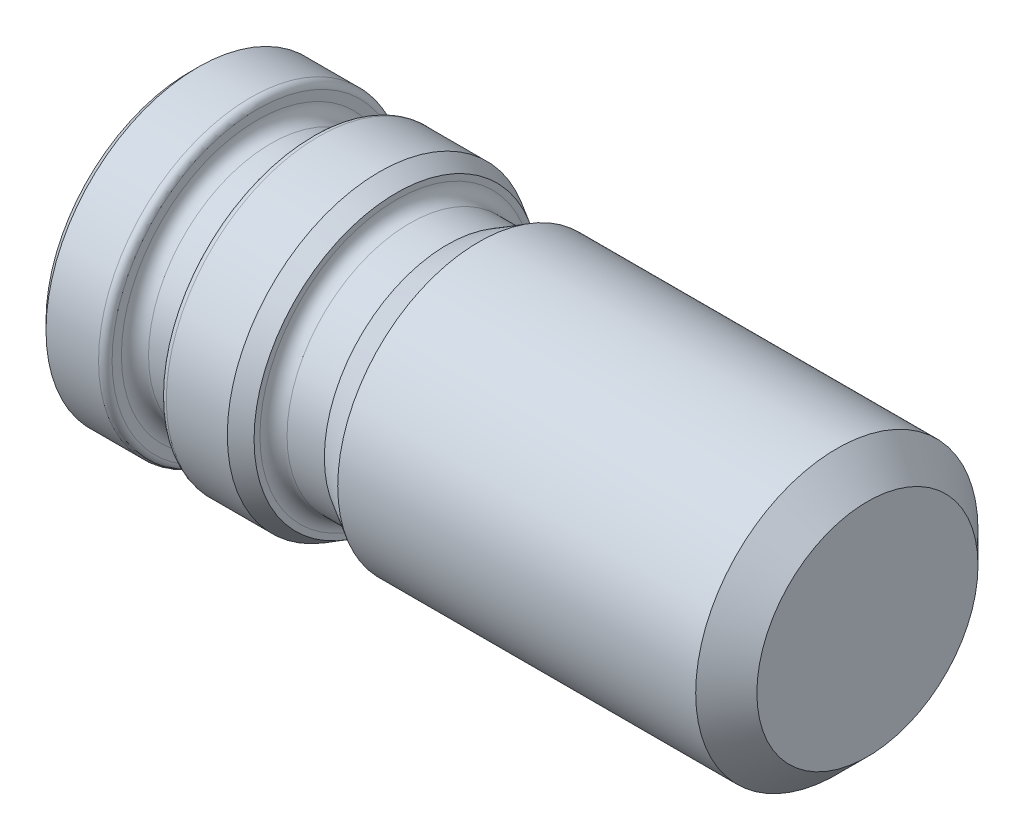
from build123d import *

# Parameters (mm, degrees)
CUT_EXTRUDE1_DEPTH = 8
CHAMFER1_SIZE      = 0.5
CHAMFER2_SIZE      = 0.5
CHAMFER3_SIZE      = 1
CHAMFER3_SIZE2     = 0.577350269


with BuildPart() as part:
    # Sketch1 → Revolve1 (revolve)
    with BuildSketch(Plane.XY, mode=Mode.PRIVATE) as revolve1_sk:
        with BuildLine():
            Line((0, 0), (0, 6.525))
            Line((0, 6.525), (-1.805, 8.33))
            Line((-1.805, 8.33), (-22.929385128, 8.33))
            Line((-22.929385128, 8.33), (-24.8, 7.25))
            Line((-24.8, 7.25), (-27, 7.25))
            ThreePointArc((-27, 7.25), (-27.565685425, 7.484314575), (-27.8, 8.05))
            Line((-27.8, 8.05), (-27.8, 8.975))
            Line((-27.8, 8.975), (-32.4, 8.975))
            ThreePointArc((-32.4, 8.975), (-32.682842712, 8.857842712), (-32.8, 8.575))
            Line((-32.8, 8.575), (-32.8, 8.025))
            ThreePointArc((-32.8, 8.025), (-33.034314575, 7.459314575), (-33.6, 7.225))
            Line((-33.6, 7.225), (-35.2, 7.225))
            ThreePointArc((-35.2, 7.225), (-35.765685425, 7.459314575), (-36, 8.025))
            Line((-36, 8.025), (-36, 8.575))
            ThreePointArc((-36, 8.575), (-36.117157288, 8.857842712), (-36.4, 8.975))
            Line((-36.4, 8.975), (-40, 8.975))
            Line((-40, 8.975), (-40, 0))
            Line((-40, 0), (0, 0))
        make_face()
    revolve(revolve1_sk.sketch.rotate(Axis((0, 0, 0), (1, 0, 0)), 90), axis=Axis((0, 0, 0), (1, 0, 0)))

    # Sketch2 → Cut-Extrude1 (cut)
    with BuildSketch(Plane.ZY.offset(40)):
        Polygon((2.367136104, 4.1), (-2.367136104, 4.1), (-4.734272207, 0), (-2.367136104, -4.1), (2.367136104, -4.1), (4.734272207, 0), align=None)
    extrude(amount=-CUT_EXTRUDE1_DEPTH, mode=Mode.SUBTRACT)

    # Chamfer1
    chamfer1_edges = [part.edges().sort_by_distance(p)[0] for p in [
        (-40, 2.05, 3.550704156),
        (-40, 4.1, 0),
        (-40, 2.05, -3.550704156),
        (-40, -2.05, -3.550704156),
        (-40, -4.1, 0),
        (-40, -2.05, 3.550704156),
    ]]
    chamfer(chamfer1_edges, length=CHAMFER1_SIZE)

    # Chamfer2
    chamfer2_edges = [part.edges().sort_by_distance(p)[0] for p in [
        (-40, 0, -8.975),
    ]]
    chamfer(chamfer2_edges, length=CHAMFER2_SIZE)

    # Chamfer3
    chamfer3_edges = [part.edges().sort_by_distance(p)[0] for p in [
        (-27.8, 0, -8.975),
    ]]
    chamfer3_side = [part.faces().sort_by_distance(p)[0] for p in [
        (-30.1, 0, -8.975),
    ]]
    chamfer(chamfer3_edges, length=CHAMFER3_SIZE, length2=CHAMFER3_SIZE2, reference=chamfer3_side[0])


solid = part.part
